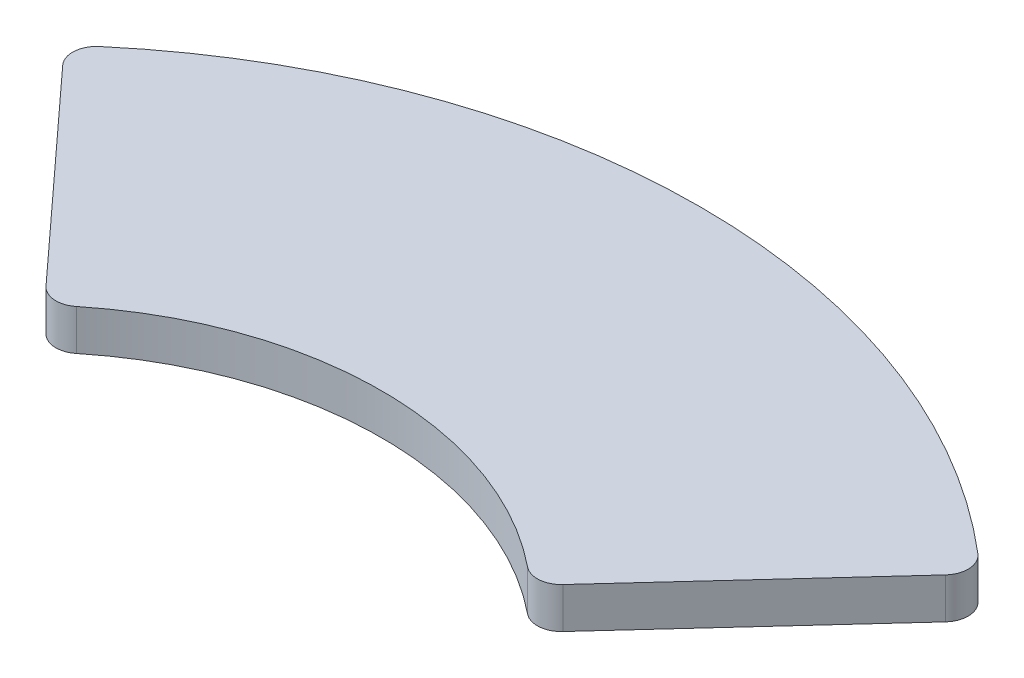
from build123d import *

# Parameters (mm, degrees)
BOSS_EXTRUDE1_DEPTH = 0.85
FILLET1_R           = 1


with BuildPart() as part:
    # Sketch1 → Boss-Extrude1 (new, symmetric)
    with BuildSketch(Plane(origin=(0, 0, 0), x_dir=(1, 0, 0), z_dir=(0, 1, 0))):
        with BuildLine():
            Line((-10.133853114, -10.590839948), (-19.119202876, -0.785051368))
            ThreePointArc((-19.119202876, -0.785051368), (0, 6.65), (19.119202876, -0.785051368))
            Line((19.119202876, -0.785051368), (10.133853114, -10.590839948))
            ThreePointArc((10.133853114, -10.590839948), (0, -6.65), (-10.133853114, -10.590839948))
        make_face()
    extrude(amount=BOSS_EXTRUDE1_DEPTH, both=True)

    # Fillet1
    fillet1_edges = [part.edges().sort_by_distance(p)[0] for p in [
        (-10.133853114, 0, 10.590839948),
        (-19.119202876, 0, 0.785051368),
        (19.119202876, 0, 0.785051368),
        (10.133853114, 0, 10.590839948),
    ]]
    fillet(fillet1_edges, radius=FILLET1_R)


solid = part.part
